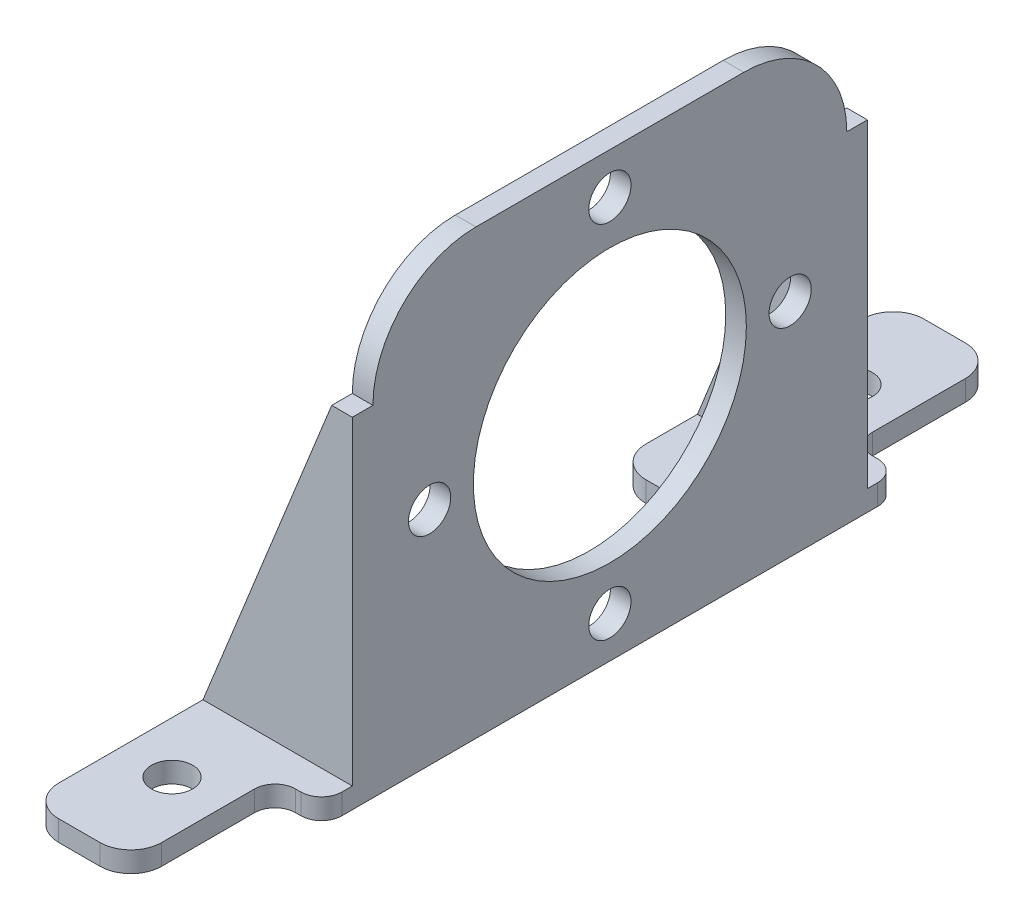
from build123d import *

# Parameters (mm, degrees)
SKETCH1_R           = 13.25
SKETCH1_R_2         = 2.05
BOSS_EXTRUDE1_DEPTH = 2
SKETCH2_R           = 2
BOSS_EXTRUDE2_DEPTH = 2
BOSS_EXTRUDE3_DEPTH = 2
BOSS_EXTRUDE4_DEPTH = 2
SKETCH6_W           = 10
SKETCH6_H           = 5
CUT_EXTRUDE2_DEPTH  = 2
FILLET1_R           = 3
FILLET_1_R          = 2
FILLET_2_R          = 3


with BuildPart() as part:
    # Sketch1 → Boss-Extrude1 (new body)
    with BuildSketch(Plane(origin=(0, 0, 0), x_dir=(0, 0, -1), z_dir=(1, 0, 0))):
        with BuildLine():
            Line((-13, 21.5), (13, 21.5))
            ThreePointArc((13, 21.5), (20.071067812, 18.571067812), (23, 11.5))
            Line((23, 11.5), (23, -21.5))
            Line((23, -21.5), (-23, -21.5))
            Line((-23, -21.5), (-23, 11.5))
            ThreePointArc((-23, 11.5), (-20.071067812, 18.571067812), (-13, 21.5))
        make_face()
        Circle(SKETCH1_R, mode=Mode.SUBTRACT)
        with Locations((0, 17.5)):
            Circle(SKETCH1_R_2, mode=Mode.SUBTRACT)
        with Locations((17.5, 0)):
            Circle(SKETCH1_R_2, mode=Mode.SUBTRACT)
        with Locations((0, -17.5)):
            Circle(SKETCH1_R_2, mode=Mode.SUBTRACT)
        with Locations((-17.5, 0)):
            Circle(SKETCH1_R_2, mode=Mode.SUBTRACT)
    extrude(amount=BOSS_EXTRUDE1_DEPTH)

    # Sketch2 → Boss-Extrude2 (add)
    # profile 1 of 2: a face of its own
    with BuildSketch(Plane.XZ.offset(21.5)):
        Polygon((-12.5, 23), (-12.5, 47), (-2.5, 47), (-2.5, 28), (2, 28), (2, 23), (0, 23), (0, 15), (-12.5, 15), align=None)
        with Locations(Location((-7.5, 33, 0), (0, 0, 90))):
            Circle(SKETCH2_R, mode=Mode.SUBTRACT)
    # profile 2 of 2: a face of its own
    with BuildSketch(Plane.XZ.offset(21.5)):
        Polygon((2, -23), (0, -23), (0, -15), (-12.5, -15), (-12.5, -23), (-12.5, -47), (-2.5, -47), (-2.5, -28), (2, -28), align=None)
        with Locations(Location((-7.5, -33, 0), (0, 0, 270))):
            Circle(SKETCH2_R, mode=Mode.SUBTRACT)
    extrude(amount=-BOSS_EXTRUDE2_DEPTH)

    # Sketch3 → Boss-Extrude3 (add)
    with BuildSketch(Plane(origin=(0, 0, -23), x_dir=(-1, 0, 0), z_dir=(0, 0, -1))):
        Polygon((-2, 11.5), (0, 11.5), (12.5, -19.5), (7.5, -19.5), (-2, -19.55), align=None)
    extrude(amount=BOSS_EXTRUDE3_DEPTH)

    # Sketch4 → Boss-Extrude4 (add)
    with BuildSketch(Plane.XY.offset(23)):
        Polygon((2, 11.5), (0, 11.5), (-12.5, -19.5), (2, -19.5), align=None)
    extrude(amount=BOSS_EXTRUDE4_DEPTH)

    # Sketch6 → Cut-Extrude2 (cut)
    with BuildSketch(Plane(origin=(0, -19.5, 0), x_dir=(1, 0, 0), z_dir=(0, 1, 0))):
        with Locations((-7.5, 44.5)):
            Rectangle(SKETCH6_W, SKETCH6_H)
        with Locations((-7.5, -44.5)):
            Rectangle(SKETCH6_W, SKETCH6_H)
    extrude(amount=-CUT_EXTRUDE2_DEPTH, mode=Mode.SUBTRACT)

    # Fillet1
    fillet1_edges = [part.edges().sort_by_distance(p)[0] for p in [
        (-2.5, -20.5, -42),
        (-12.5, -20.5, -42),
        (-12.5, -20.5, 42),
        (-2.5, -20.5, 42),
    ]]
    fillet(fillet1_edges, radius=FILLET1_R)

    # 圆角1
    fillet_1_edges = [part.edges().sort_by_distance(p)[0] for p in [
        (2, -20.5, -28),
        (-2.5, -20.5, -28),
        (-2.5, -20.5, 28),
        (2, -20.5, 28),
    ]]
    fillet(fillet_1_edges, radius=FILLET_1_R)

    # 圆角2
    fillet_2_edges = [part.edges().sort_by_distance(p)[0] for p in [
        (-12.5, -20.5, -15),
        (-12.5, -20.5, 15),
    ]]
    fillet(fillet_2_edges, radius=FILLET_2_R)


solid = part.part
